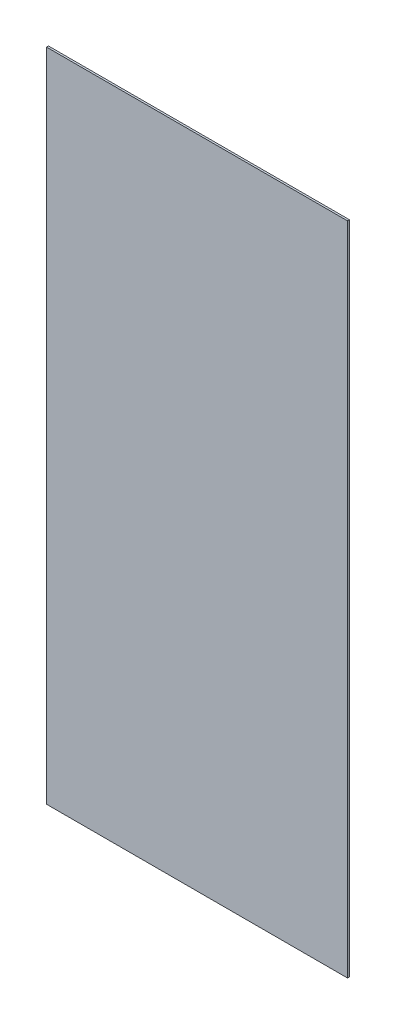
from build123d import *

# Parameters (mm, degrees)
SZKIC1_W                    = 780
SZKIC1_H                    = 1700
DODANIE_WYCI_GNI_CIE1_DEPTH = 5


with BuildPart() as part:
    # Szkic1 → Dodanie-wyciągnięcie1 (new body)
    with BuildSketch(Plane.XY):
        with Locations((390, 850)):
            Rectangle(SZKIC1_W, SZKIC1_H)
    extrude(amount=DODANIE_WYCI_GNI_CIE1_DEPTH)


solid = part.part
